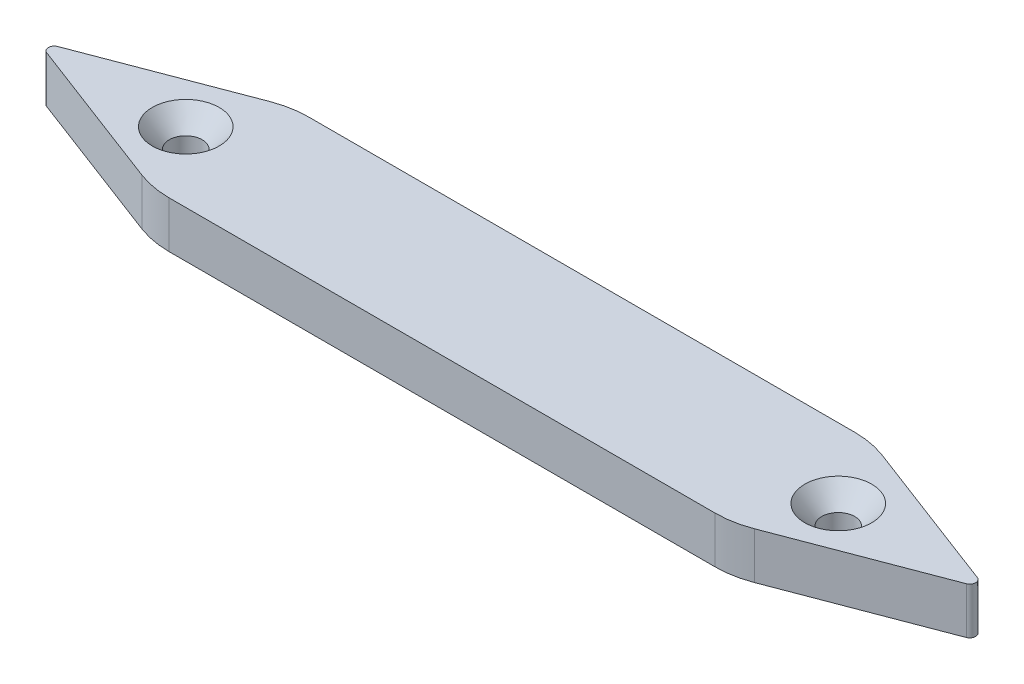
from build123d import *

# Parameters (mm, degrees)
BOSS_EXTRUDE2_DEPTH                               = 22.225
BOSS_EXTRUDE2_DEPTH_BACK                          = 10
SKETCH2_W                                         = 153.14353988
SKETCH2_H                                         = 6.35
CUT_EXTRUDE1_DEPTH                                = 4.7625
SKETCH3_W                                         = 152.758434582
SKETCH3_H                                         = 6.35
CUT_EXTRUDE2_DEPTH                                = 4.7625
FILLET3_R                                         = 12.7
FILLET4_R                                         = 12.7
FILLET5_R                                         = 12.7
FILLET6_R                                         = 12.7
CUT_EXTRUDE3_DEPTH                                = 94.675
CUT_EXTRUDE3_DEPTH_BACK                           = 84.675
SKETCH12_R                                        = 168.402
CSK_FOR_8_FLAT_HEAD_SOCKET_CAP_SCREW2_D           = 4.4958
CSK_FOR_8_FLAT_HEAD_SOCKET_CAP_SCREW2_CSINK_D     = 9.1186
CSK_FOR_8_FLAT_HEAD_SOCKET_CAP_SCREW2_CSINK_ANGLE = 82
SKETCH24_W                                        = 181.235061551
SKETCH24_H                                        = 69.255288946
CUT_EXTRUDE5_DEPTH                                = 84.675


with BuildPart() as part:
    # Sketch1 → Boss-Extrude2 (new, two sides: drawn at the far end of the back side and taken through both)
    with BuildSketch(Plane(origin=(0, 0, 0), x_dir=(1, 0, 0), z_dir=(0, 1, 0)).offset(-BOSS_EXTRUDE2_DEPTH_BACK)):
        with BuildLine():
            Line((37.204956004, 9.525), (-37.204956004, 9.525))
            ThreePointArc((-37.204956004, 9.525), (-39.498289417, 9.316221792), (-41.716221563, 8.696751473))
            Line((-41.716221563, 8.696751473), (-62.649818949, 0.741984467))
            ThreePointArc((-62.649818949, 0.741984467), (-63.161614851, 0), (-62.649818949, -0.741984467))
            Line((-62.649818949, -0.741984467), (-41.716221563, -8.696751473))
            ThreePointArc((-41.716221563, -8.696751473), (-39.498289417, -9.316221792), (-37.204956004, -9.525))
            Line((-37.204956004, -9.525), (37.204956004, -9.525))
            ThreePointArc((37.204956004, -9.525), (39.498289417, -9.316221792), (41.716221563, -8.696751473))
            Line((41.716221563, -8.696751473), (62.649818949, -0.741984467))
            ThreePointArc((62.649818949, -0.741984467), (63.161614851, 0), (62.649818949, 0.741984467))
            Line((62.649818949, 0.741984467), (41.716221563, 8.696751473))
            ThreePointArc((41.716221563, 8.696751473), (39.498289417, 9.316221792), (37.204956004, 9.525))
        make_face()
    extrude(amount=BOSS_EXTRUDE2_DEPTH + BOSS_EXTRUDE2_DEPTH_BACK)

    # Sketch2 → Cut-Extrude1 (cut)
    with BuildSketch(Plane.XY.offset(9.525)):
        with Locations((7.894658594, 12.7)):
            Rectangle(SKETCH2_W, SKETCH2_H)
    extrude(amount=-CUT_EXTRUDE1_DEPTH, mode=Mode.SUBTRACT)

    # Sketch3 → Cut-Extrude2 (cut)
    with BuildSketch(Plane(origin=(0, 0, -9.525), x_dir=(-1, 0, 0), z_dir=(0, 0, -1))):
        with Locations((8.600684972, 12.7)):
            Rectangle(SKETCH3_W, SKETCH3_H)
    extrude(amount=-CUT_EXTRUDE2_DEPTH, mode=Mode.SUBTRACT)

    # Fillet3
    fillet3_edges = [part.edges().sort_by_distance(p)[0] for p in [
        (52.069514915, 12.7, -4.7625),
    ]]
    fillet(fillet3_edges, radius=FILLET3_R)

    # Fillet4
    fillet4_edges = [part.edges().sort_by_distance(p)[0] for p in [
        (52.069514915, 12.7, 4.7625),
    ]]
    fillet(fillet4_edges, radius=FILLET4_R)

    # Fillet5
    fillet5_edges = [part.edges().sort_by_distance(p)[0] for p in [
        (-52.069514915, 12.7, 4.7625),
    ]]
    fillet(fillet5_edges, radius=FILLET5_R)

    # Fillet6
    fillet6_edges = [part.edges().sort_by_distance(p)[0] for p in [
        (-52.069514915, 12.7, -4.7625),
    ]]
    fillet(fillet6_edges, radius=FILLET6_R)

    # Sketch12 → Cut-Extrude3 (cut, two sides: drawn at the far end of the back side and taken through both)
    with BuildSketch(Plane(origin=(0, 0, 0), x_dir=(0, 0, -1), z_dir=(1, 0, 0)).offset(-CUT_EXTRUDE3_DEPTH_BACK)):
        with Locations((0, -168.402)):
            Circle(SKETCH12_R)
    extrude(amount=CUT_EXTRUDE3_DEPTH + CUT_EXTRUDE3_DEPTH_BACK, mode=Mode.SUBTRACT)

    # CSK for #8 Flat Head Socket Cap Screw2 (through all)
    with Locations(Plane(origin=(0, 22.225, 0), x_dir=(1, 0, 0), z_dir=(0, 1, 0))):
        with Locations((-44.45, 0), (44.45, 0)):
            CounterSinkHole(CSK_FOR_8_FLAT_HEAD_SOCKET_CAP_SCREW2_D / 2, CSK_FOR_8_FLAT_HEAD_SOCKET_CAP_SCREW2_CSINK_D / 2, counter_sink_angle=CSK_FOR_8_FLAT_HEAD_SOCKET_CAP_SCREW2_CSINK_ANGLE)

    # Sketch24 → Cut-Extrude5 (cut)
    with BuildSketch(Plane(origin=(0, 15.875, 0), x_dir=(1, 0, 0), z_dir=(0, 1, 0))):
        with Locations((3.936847216, -3.169453317)):
            Rectangle(SKETCH24_W, SKETCH24_H)
    extrude(amount=-CUT_EXTRUDE5_DEPTH, mode=Mode.SUBTRACT)


solid = part.part
